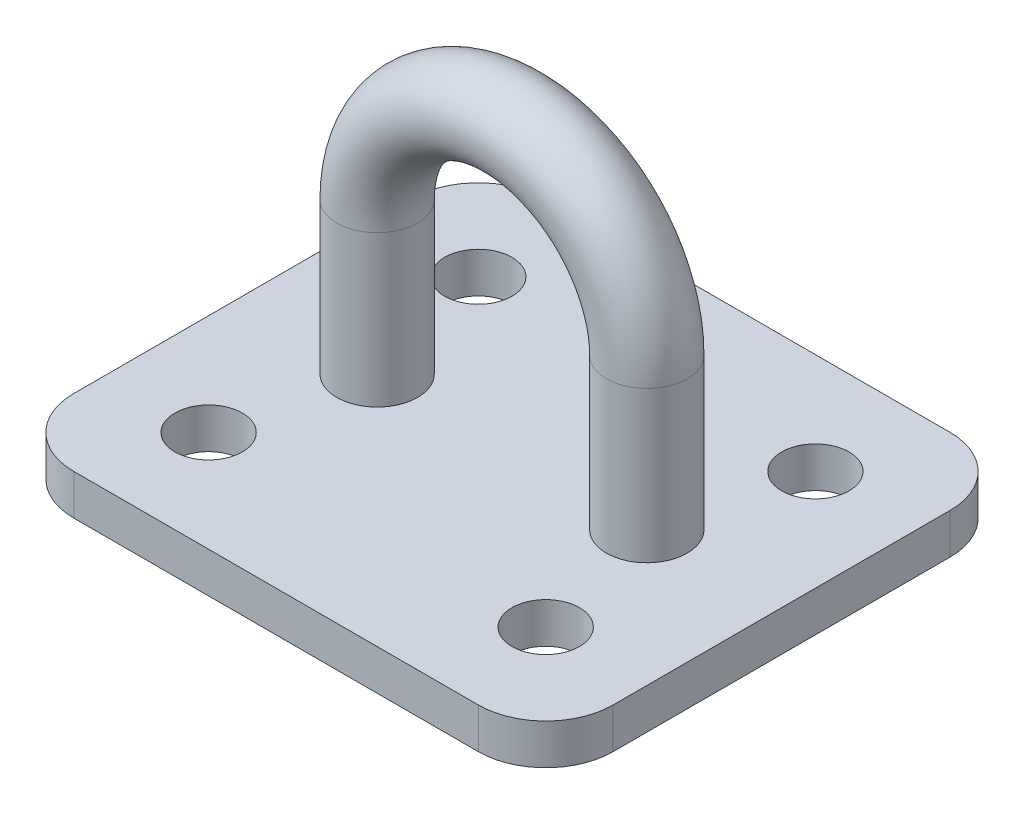
from build123d import *

# Parameters (mm, degrees)
SKETCH1_R           = 2.5
BOSS_EXTRUDE1_DEPTH = 3
SKETCH2_R           = 3


with BuildPart() as part:
    # Sketch1 → Boss-Extrude1 (new body)
    with BuildSketch(Plane(origin=(0, 0, 0), x_dir=(1, 0, 0), z_dir=(0, 1, 0))):
        with BuildLine():
            Line((15, -17.5), (-15, -17.5))
            ThreePointArc((-15, -17.5), (-18.535533906, -16.035533906), (-20, -12.5))
            Line((-20, -12.5), (-20, 12.5))
            ThreePointArc((-20, 12.5), (-18.535533906, 16.035533906), (-15, 17.5))
            Line((-15, 17.5), (15, 17.5))
            ThreePointArc((15, 17.5), (18.535533906, 16.035533906), (20, 12.5))
            Line((20, 12.5), (20, -12.5))
            ThreePointArc((20, -12.5), (18.535533906, -16.035533906), (15, -17.5))
        make_face()
        with Locations(Location((-12.5, 10, 0), (0, 0, 270))):
            Circle(SKETCH1_R, mode=Mode.SUBTRACT)
        with Locations(Location((12.5, 10, 0), (0, 0, 270))):
            Circle(SKETCH1_R, mode=Mode.SUBTRACT)
        with Locations(Location((-12.5, -10, 0), (0, 0, 270))):
            Circle(SKETCH1_R, mode=Mode.SUBTRACT)
        with Locations(Location((12.5, -10, 0), (0, 0, 270))):
            Circle(SKETCH1_R, mode=Mode.SUBTRACT)
    extrude(amount=BOSS_EXTRUDE1_DEPTH)

    # Sweep1: sweep along a path in Sketch3
    with BuildLine(Plane.XY) as sweep1_path:
        Line((-10, 0), (-10, 14.2))
        ThreePointArc((-10, 14.2), (0, 24.2), (10, 14.2))
        Line((10, 14.2), (10, 0))
    # Sketch2 → Sweep1 (sweep)
    with BuildSketch(Plane(origin=(0, 0, 0), x_dir=(1, 0, 0), z_dir=(0, 1, 0))):
        with Locations((-10, 0)):
            Circle(SKETCH2_R)
    sweep(path=sweep1_path.line)


solid = part.part
